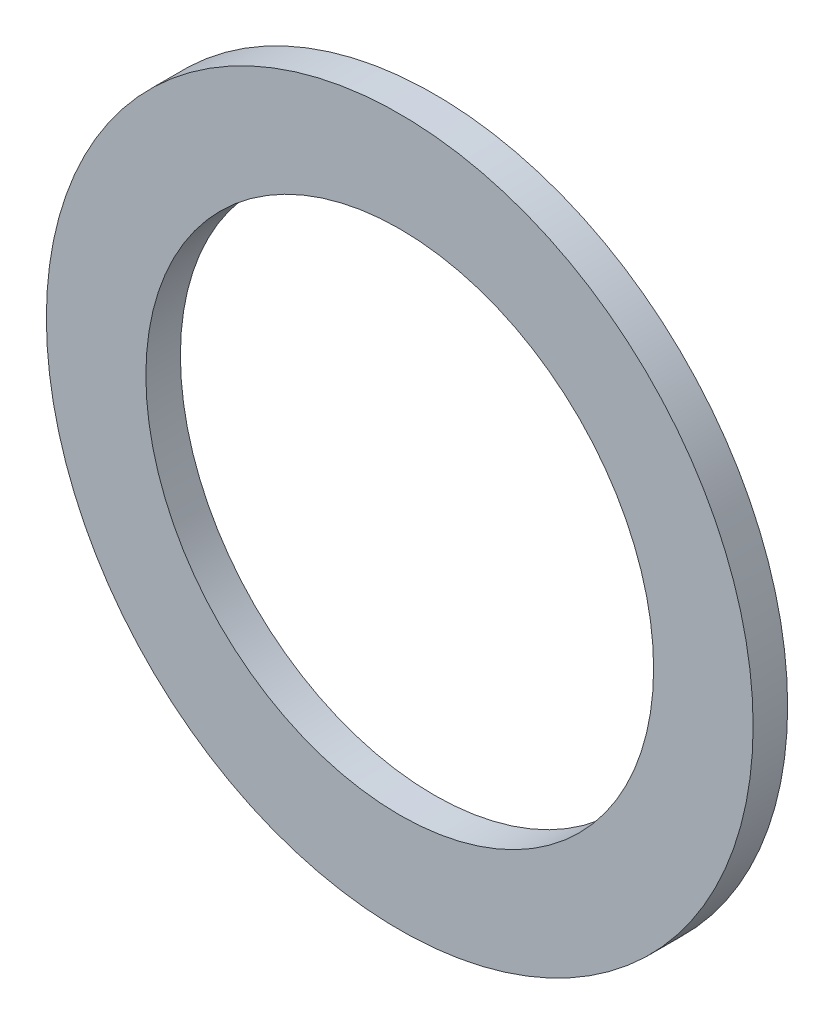
from build123d import *

# Parameters (mm, degrees)
ESQUISSE1_R          = 17.4
ESQUISSE1_R_2        = 12.5
BASE_EXTRUSION_DEPTH = 1.7


with BuildPart() as part:
    # Esquisse1 → Base-Extrusion (new body)
    with BuildSketch(Plane.XY):
        Circle(ESQUISSE1_R)
        Circle(ESQUISSE1_R_2, mode=Mode.SUBTRACT)
    extrude(amount=BASE_EXTRUSION_DEPTH)


solid = part.part
